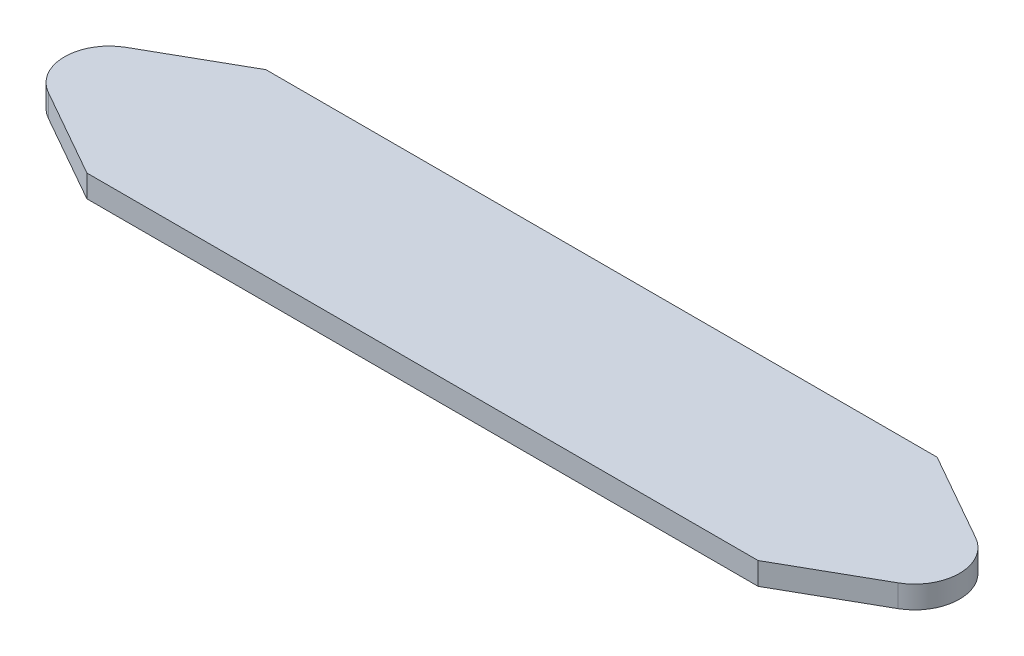
from build123d import *

# Parameters (mm, degrees)
EXTRUDE_1_DEPTH = 10


with BuildPart() as part:
    # 草图1 → 凸台-拉伸1 (new body)
    with BuildSketch(Plane(origin=(0, 0, 0), x_dir=(1, 0, 0), z_dir=(0, 1, 0))):
        with BuildLine():
            Line((-189.864242224, 17.398181668), (-150, 40))
            Line((-150, 40), (150, 40))
            Line((150, 40), (189.864242224, 17.398181668))
            ThreePointArc((189.864242224, 17.398181668), (200, 0), (189.864242224, -17.398181668))
            Line((189.864242224, -17.398181668), (150, -40))
            Line((150, -40), (-150, -40))
            Line((-150, -40), (-189.864242224, -17.398181668))
            ThreePointArc((-189.864242224, -17.398181668), (-200, 0), (-189.864242224, 17.398181668))
        make_face()
    extrude(amount=EXTRUDE_1_DEPTH)


solid = part.part
